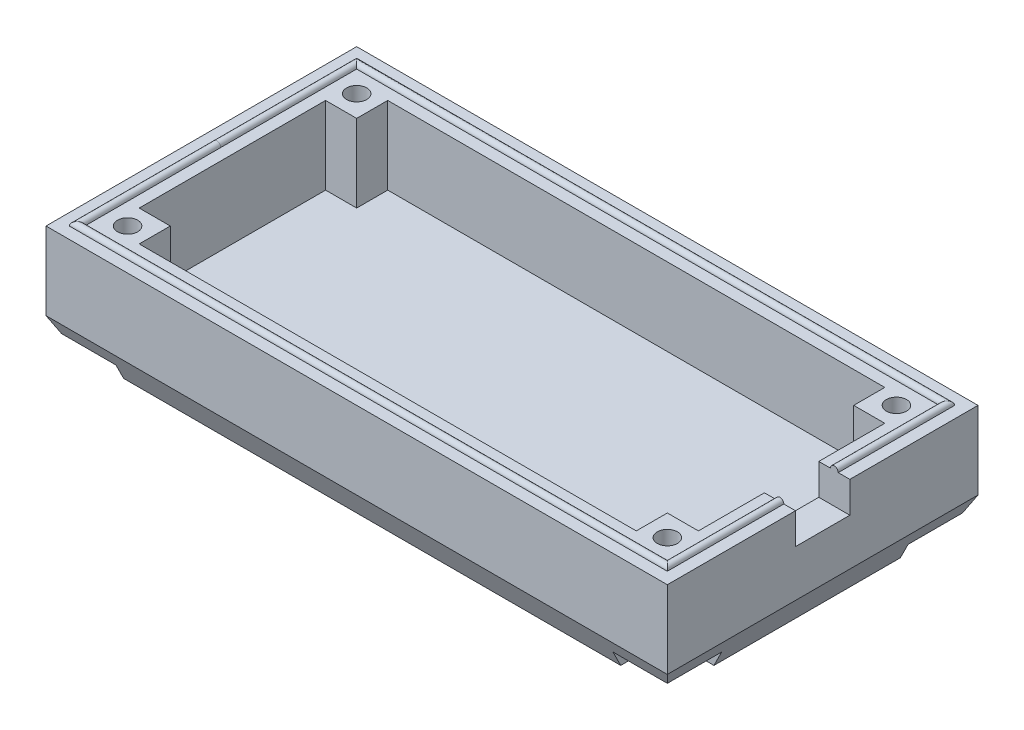
from build123d import *

# Parameters (mm, degrees)
SCHIZZO2_W                     = 40
SCHIZZO2_H                     = 20
ESTRUSIONE_ESTRUSIONE1_DEPTH   = 7
TAGLIO_ESTRUSIONE1_DEPTH       = 5
SMUSSO1_SIZE                   = 1
SMUSSO1_SIZE2                  = 2
SCHIZZO6_W                     = 4
SCHIZZO6_H                     = 4
TAGLIO_ESTRUSIONE2_DEPTH       = 1
FORO_PER_VITE_M1_1_D           = 1.3
FORO_PER_VITE_M1_1_CSINK_D     = 1.35
FORO_PER_VITE_M1_1_CSINK_ANGLE = 90
SPECCHIA2_COPY_1_D             = 1.3
SPECCHIA2_COPY_1_CSINK_D       = 1.35
SPECCHIA2_COPY_1_CSINK_ANGLE   = 90
TAGLIO_ESTRUSIONE3_DEPTH       = 42.821047333
TAGLIO_ESTRUSIONE3_DEPTH_BACK  = 3
SCHIZZO14_W                    = 3.5
SCHIZZO14_H                    = 4


with BuildPart() as part:
    # Schizzo2 → Estrusione-Estrusione1 (new body)
    with BuildSketch(Plane(origin=(0, 0, 0), x_dir=(1, 0, 0), z_dir=(0, 1, 0))):
        Rectangle(SCHIZZO2_W, SCHIZZO2_H)
    extrude(amount=-ESTRUSIONE_ESTRUSIONE1_DEPTH)

    # Schizzo3 → Taglio-Estrusione1 (cut)
    with BuildSketch(Plane(origin=(0, 0, 0), x_dir=(1, 0, 0), z_dir=(0, 1, 0))):
        Polygon((-16, 8), (16, 8), (16, 6), (18, 6), (18, -6), (16, -6), (16, -8), (-16, -8), (-16, -6), (-18, -6), (-18, 6), (-16, 6), align=None)
    extrude(amount=-TAGLIO_ESTRUSIONE1_DEPTH, mode=Mode.SUBTRACT)

    # Sweep1: sweep along a path in Schizzo5
    with BuildLine(Plane(origin=(0, 0, 0), x_dir=(1, 0, 0), z_dir=(0, 1, 0))) as sweep1_path:
        Line((19, -9), (-19, -9))
        Line((-19, -9), (-19, 9))
        Line((-19, 9), (19, 9))
        Line((19, 9), (19, -9))
    # Schizzo4 → Sweep1 (sweep)
    with BuildSketch(Plane.XY):
        with BuildLine():
            Line((-18.75, 0), (-19.25, 0))
            ThreePointArc((-19.25, 0), (-19, 0.25), (-18.75, 0))
        make_face()
    sweep(path=sweep1_path.line, transition=Transition.RIGHT)

    # Smusso1
    smusso1_edges = [part.edges().sort_by_distance(p)[0] for p in [
        (20, -7, 0),
        (0, -7, -10),
        (-20, -7, 0),
        (0, -7, 10),
    ]]
    smusso1_side = [part.faces().sort_by_distance(p)[0] for p in [
        (0, -7, 0),
    ]]
    chamfer(smusso1_edges, length=SMUSSO1_SIZE, length2=SMUSSO1_SIZE2, reference=smusso1_side[0])

    # Schizzo6 → Taglio-Estrusione2 (cut)
    with BuildSketch(Plane.XZ.offset(7)):
        with Locations((-18, 8)):
            Rectangle(SCHIZZO6_W, SCHIZZO6_H)
        with Locations((18, 8)):
            Rectangle(SCHIZZO6_W, SCHIZZO6_H)
        with Locations((18, -8)):
            Rectangle(SCHIZZO6_W, SCHIZZO6_H)
        with Locations((-18, -8)):
            Rectangle(SCHIZZO6_W, SCHIZZO6_H)
    extrude(amount=-TAGLIO_ESTRUSIONE2_DEPTH, mode=Mode.SUBTRACT)

    # Foro per Vite M1-1 (through all)
    with Locations(Plane(origin=(0, -6, 0), x_dir=(-1, 0, 0), z_dir=(0, -1, 0))):
        with Locations((-17.375, 7.375)):
            foro_per_vite_m1_1 = CounterSinkHole(FORO_PER_VITE_M1_1_D / 2, FORO_PER_VITE_M1_1_CSINK_D / 2, counter_sink_angle=FORO_PER_VITE_M1_1_CSINK_ANGLE)

    # Specchia1: Foro per Vite M1-1 across plane
    add(foro_per_vite_m1_1.mirror(Plane(origin=(0, 0, 0), x_dir=(0, 0, 1), z_dir=(1, 0, 0))), mode=Mode.SUBTRACT)

    # Specchia2: Foro per Vite M1-1 across plane
    add(foro_per_vite_m1_1.mirror(Plane.XY), mode=Mode.SUBTRACT)

    # Specchia2 copy 1 (through all)
    with Locations(Plane.XZ.offset(6)):
        with Locations((-17.375, 7.375)):
            CounterSinkHole(SPECCHIA2_COPY_1_D / 2, SPECCHIA2_COPY_1_CSINK_D / 2, counter_sink_angle=SPECCHIA2_COPY_1_CSINK_ANGLE)

    # Schizzo14 → Taglio-Estrusione3 (cut, two sides: drawn at the far end of the back side and taken through both)
    with BuildSketch(Plane(origin=(20, 0, 0), x_dir=(0, 0, -1), z_dir=(1, 0, 0)).offset(-TAGLIO_ESTRUSIONE3_DEPTH_BACK)):
        Rectangle(SCHIZZO14_W, SCHIZZO14_H)
    extrude(amount=TAGLIO_ESTRUSIONE3_DEPTH + TAGLIO_ESTRUSIONE3_DEPTH_BACK, mode=Mode.SUBTRACT)


solid = part.part
